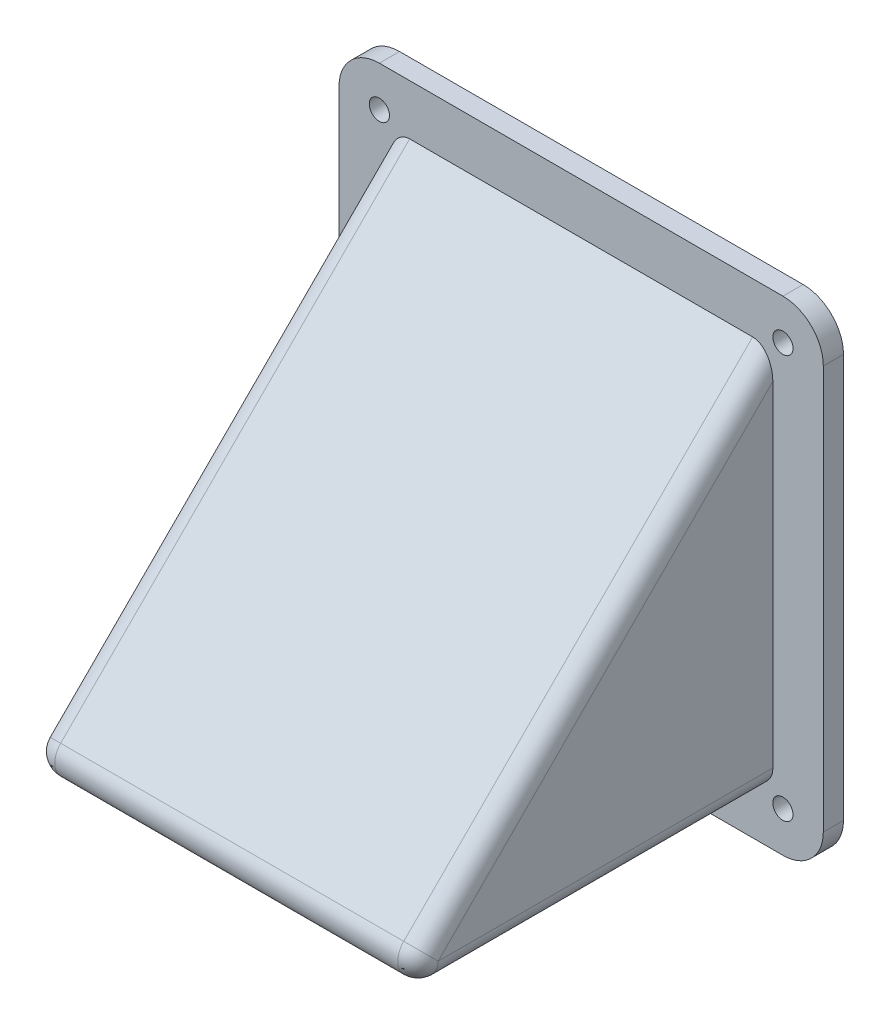
from build123d import *

# Parameters (mm, degrees)
SKETCH2_W           = 120
SKETCH2_H           = 120
SKETCH2_R           = 2.5
SKETCH2_W_2         = 87.5
SKETCH2_H_2         = 87.5
BOSS_EXTRUDE1_DEPTH = 5
SKETCH3_W           = 95
SKETCH3_H           = 95
BOSS_EXTRUDE2_DEPTH = 95
CUT_EXTRUDE1_DEPTH  = 95
CUT_EXTRUDE4_REACH  = 191.621
SKETCH5_W           = 87.5
SKETCH5_H           = 87.5
CUT_EXTRUDE5_REACH  = 196.487
SKETCH9_W           = 87.5
SKETCH9_H           = 83.964466094
CUT_EXTRUDE7_DEPTH  = 87.5
BOSS_EXTRUDE3_REACH = 194.683
SKETCH11_W          = 87.5
SKETCH11_H          = 3.75
FILLET1_R           = 10
FILLET2_R           = 5
CUT_EXTRUDE9_DEPTH  = 5.5


with BuildPart() as part:
    # Sketch2 → Boss-Extrude1 (new body)
    with BuildSketch(Plane.XY):
        with Locations((60, -60)):
            Rectangle(SKETCH2_W, SKETCH2_H)
        with Locations((10, -10.00000061)):
            Circle(SKETCH2_R, mode=Mode.SUBTRACT)
        with Locations((110, -10)):
            Circle(SKETCH2_R, mode=Mode.SUBTRACT)
        with Locations((9.988952602, -110)):
            Circle(SKETCH2_R, mode=Mode.SUBTRACT)
        with Locations((109.988952602, -110)):
            Circle(SKETCH2_R, mode=Mode.SUBTRACT)
        with Locations((60, -60)):
            Rectangle(SKETCH2_W_2, SKETCH2_H_2, mode=Mode.SUBTRACT)
    extrude(amount=BOSS_EXTRUDE1_DEPTH)

    # Sketch3 → Boss-Extrude2 (add)
    with BuildSketch(Plane.XY.offset(5)):
        with Locations((60, -60)):
            Rectangle(SKETCH3_W, SKETCH3_H)
    extrude(amount=BOSS_EXTRUDE2_DEPTH)

    # Sketch4 → Cut-Extrude1 (cut)
    with BuildSketch(Plane(origin=(107.5, 0, 0), x_dir=(0, 0, -1), z_dir=(1, 0, 0))):
        Polygon((-5, -12.5), (-100, -107.5), (-100, -12.5), align=None)
    extrude(amount=-CUT_EXTRUDE1_DEPTH, mode=Mode.SUBTRACT)

    # Cut-Extrude4: up to this plane
    cut_extrude4_end = Plane(origin=(12.5, -14.267766953, 3.232233047), z_dir=(0, -0.7071067811865476, -0.7071067811865476))
    # Sketch5 → Cut-Extrude4 (cut, up to the surface)
    with BuildSketch(Plane.XZ.offset(107.5), mode=Mode.PRIVATE) as cut_extrude4_sk1:
        with Locations((60, 52.5)):
            Rectangle(SKETCH5_W, SKETCH5_H)
    cut_extrude4_tool1 = split(extrude(cut_extrude4_sk1.sketch, amount=-CUT_EXTRUDE4_REACH, mode=Mode.PRIVATE), bisect_by=cut_extrude4_end, keep=Keep.BOTH, mode=Mode.PRIVATE)
    add(cut_extrude4_tool1.solids().sort_by_distance((60, -107.5, 52.5))[0], mode=Mode.SUBTRACT)

    # Cut-Extrude5: up to this plane
    cut_extrude5_end = Plane(origin=(12.5, -14.267766953, 3.232233047), z_dir=(0, -0.7071067811865476, -0.7071067811865476))
    # Sketch9 → Cut-Extrude5 (cut, up to the surface)
    with BuildSketch(Plane(origin=(0, 0, 5), x_dir=(-1, 0, 0), z_dir=(0, 0, -1)), mode=Mode.PRIVATE) as cut_extrude5_sk1:
        with Locations((-60, -61.767766953)):
            Rectangle(SKETCH9_W, SKETCH9_H)
    cut_extrude5_tool1 = split(extrude(cut_extrude5_sk1.sketch, amount=-CUT_EXTRUDE5_REACH, mode=Mode.PRIVATE), bisect_by=cut_extrude5_end, keep=Keep.BOTH, mode=Mode.PRIVATE)
    add(cut_extrude5_tool1.solids().sort_by_distance((60, -61.767767, 5))[0], mode=Mode.SUBTRACT)

    # Sketch10 → Cut-Extrude7 (cut)
    with BuildSketch(Plane.ZY.offset(-103.75)):
        Polygon((8.75, -19.785533906), (5, -19.785533906), (5, -16.25), align=None)
    extrude(amount=CUT_EXTRUDE7_DEPTH, mode=Mode.SUBTRACT)

    # Sketch11 → Boss-Extrude3 (add, up to next)
    with BuildSketch(Plane.XY.offset(8.75), mode=Mode.PRIVATE) as boss_extrude3_sk1:
        with Locations((60, -105.625)):
            Rectangle(SKETCH11_W, SKETCH11_H)
    boss_extrude3_tool1 = extrude(boss_extrude3_sk1.sketch, amount=BOSS_EXTRUDE3_REACH, mode=Mode.PRIVATE) - part.part
    add(boss_extrude3_tool1.solids().sort_by_distance((60, -105.625, 8.75))[0])

    # Fillet1
    fillet1_edges = [part.edges().sort_by_distance(p)[0] for p in [
        (0, 0, 2.5),
        (120, 0, 2.5),
        (120, -120, 2.5),
        (0, -120, 2.5),
    ]]
    fillet(fillet1_edges, radius=FILLET1_R)

    # Fillet2
    fillet2_edges = [part.edges().sort_by_distance(p)[0] for p in [
        (12.5, -107.5, 52.5),
        (107.5, -107.5, 52.5),
        (60, -107.5, 100),
        (12.5, -60, 52.5),
        (107.5, -60, 52.5),
    ]]
    fillet(fillet2_edges, radius=FILLET2_R)

    # Sketch16 → Cut-Extrude9 (cut)
    with BuildSketch(Plane.XZ.offset(107.5)):
        with BuildLine():
            Line((20, 82.928932188), (20, 12.5))
            ThreePointArc((20, 12.5), (22.5, 10), (25, 12.5))
            Line((25, 12.5), (25, 82.928932188))
            ThreePointArc((25, 82.928932188), (22.5, 85.428932188), (20, 82.928932188))
        make_face()
        with BuildLine():
            Line((27.5, 82.928932188), (27.5, 12.5))
            ThreePointArc((27.5, 12.5), (30, 10), (32.5, 12.5))
            Line((32.5, 12.5), (32.5, 82.928932188))
            ThreePointArc((32.5, 82.928932188), (30, 85.428932188), (27.5, 82.928932188))
        make_face()
        with BuildLine():
            Line((35, 82.928932188), (35, 12.5))
            ThreePointArc((35, 12.5), (37.5, 10), (40, 12.5))
            Line((40, 12.5), (40, 82.928932188))
            ThreePointArc((40, 82.928932188), (37.5, 85.428932188), (35, 82.928932188))
        make_face()
        with BuildLine():
            Line((42.5, 82.928932188), (42.5, 12.5))
            ThreePointArc((42.5, 12.5), (45, 10), (47.5, 12.5))
            Line((47.5, 12.5), (47.5, 82.928932188))
            ThreePointArc((47.5, 82.928932188), (45, 85.428932188), (42.5, 82.928932188))
        make_face()
        with BuildLine():
            Line((50, 82.928932188), (50, 12.5))
            ThreePointArc((50, 12.5), (52.5, 10), (55, 12.5))
            Line((55, 12.5), (55, 82.928932188))
            ThreePointArc((55, 82.928932188), (52.5, 85.428932188), (50, 82.928932188))
        make_face()
        with BuildLine():
            Line((57.5, 82.928932188), (57.5, 12.5))
            ThreePointArc((57.5, 12.5), (60, 10), (62.5, 12.5))
            Line((62.5, 12.5), (62.5, 82.928932188))
            ThreePointArc((62.5, 82.928932188), (60, 85.428932188), (57.5, 82.928932188))
        make_face()
        with BuildLine():
            Line((65, 82.928932188), (65, 12.5))
            ThreePointArc((65, 12.5), (67.5, 10), (70, 12.5))
            Line((70, 12.5), (70, 82.928932188))
            ThreePointArc((70, 82.928932188), (67.5, 85.428932188), (65, 82.928932188))
        make_face()
        with BuildLine():
            Line((72.5, 82.928932188), (72.5, 12.5))
            ThreePointArc((72.5, 12.5), (75, 10), (77.5, 12.5))
            Line((77.5, 12.5), (77.5, 82.928932188))
            ThreePointArc((77.5, 82.928932188), (75, 85.428932188), (72.5, 82.928932188))
        make_face()
        with BuildLine():
            Line((80, 82.928932188), (80, 12.5))
            ThreePointArc((80, 12.5), (82.5, 10), (85, 12.5))
            Line((85, 12.5), (85, 82.928932188))
            ThreePointArc((85, 82.928932188), (82.5, 85.428932188), (80, 82.928932188))
        make_face()
        with BuildLine():
            Line((87.5, 82.928932188), (87.5, 12.5))
            ThreePointArc((87.5, 12.5), (90, 10), (92.5, 12.5))
            Line((92.5, 12.5), (92.5, 82.928932188))
            ThreePointArc((92.5, 82.928932188), (90, 85.428932188), (87.5, 82.928932188))
        make_face()
        with BuildLine():
            Line((95, 82.928932188), (95, 12.5))
            ThreePointArc((95, 12.5), (97.5, 10), (100, 12.5))
            Line((100, 12.5), (100, 82.928932188))
            ThreePointArc((100, 82.928932188), (97.5, 85.428932188), (95, 82.928932188))
        make_face()
    extrude(amount=-CUT_EXTRUDE9_DEPTH, mode=Mode.SUBTRACT)


solid = part.part
